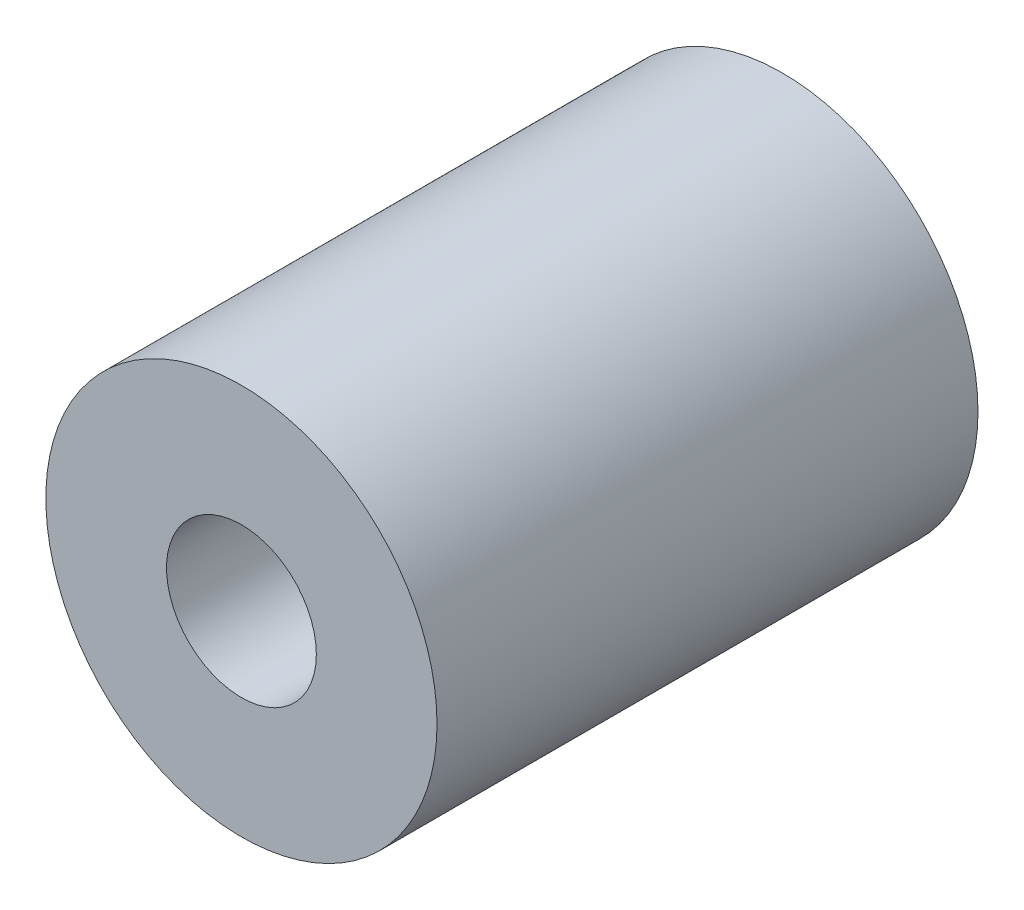
from build123d import *

# Parameters (mm, degrees)
BOSS_EXTRUDE1_DEPTH      = 26.416
BOSS_EXTRUDE1_DEPTH_BACK = 25.4
SKETCH1_R                = 18.732822776
SKETCH2_R                = 7.174960668
CUT_EXTRUDE1_DEPTH       = 192.024


with BuildPart() as part:
    # Sketch1 → Boss-Extrude1 (new, two sides: drawn at the far end of the back side and taken through both)
    with BuildSketch(Plane.XY.offset(-BOSS_EXTRUDE1_DEPTH_BACK)):
        Circle(SKETCH1_R)
    extrude(amount=BOSS_EXTRUDE1_DEPTH + BOSS_EXTRUDE1_DEPTH_BACK)

    # Sketch2 → Cut-Extrude1 (cut)
    with BuildSketch(Plane.XY.offset(26.416)):
        Circle(SKETCH2_R)
    extrude(amount=-CUT_EXTRUDE1_DEPTH, mode=Mode.SUBTRACT)


solid = part.part
